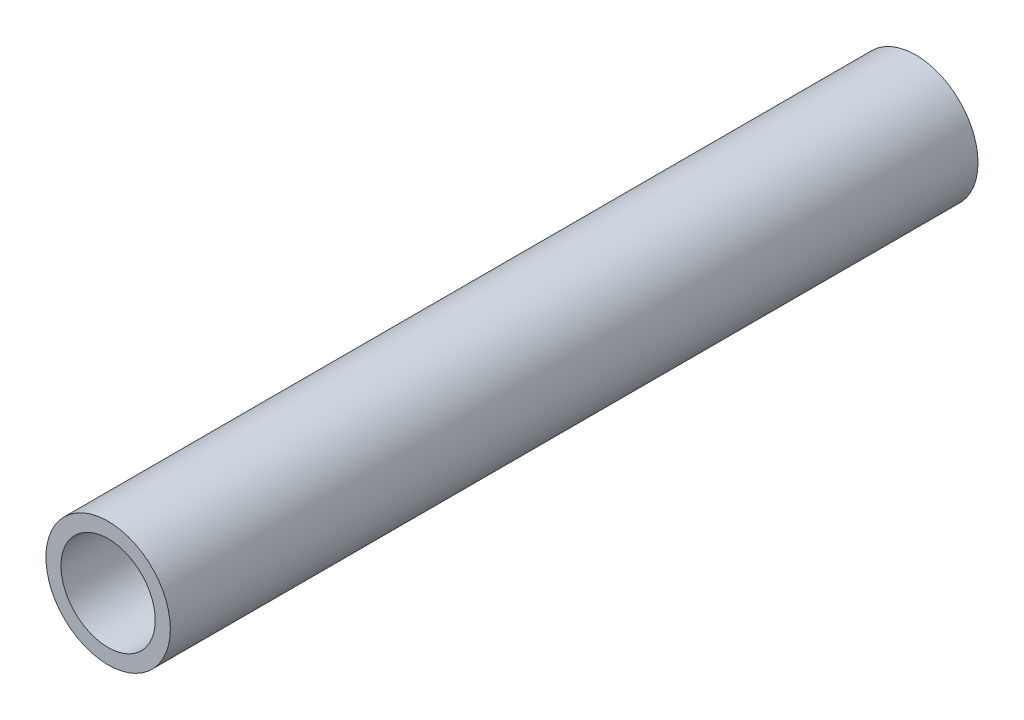
from build123d import *

# Parameters (mm, degrees)
SKETCH1_R           = 14.6685
SKETCH1_R_2         = 11.1125
BOSS_EXTRUDE1_DEPTH = 95.2


with BuildPart() as part:
    # Sketch1 → Boss-Extrude1 (new, symmetric)
    with BuildSketch(Plane.XY):
        Circle(SKETCH1_R)
        Circle(SKETCH1_R_2, mode=Mode.SUBTRACT)
    extrude(amount=BOSS_EXTRUDE1_DEPTH, both=True)


solid = part.part
